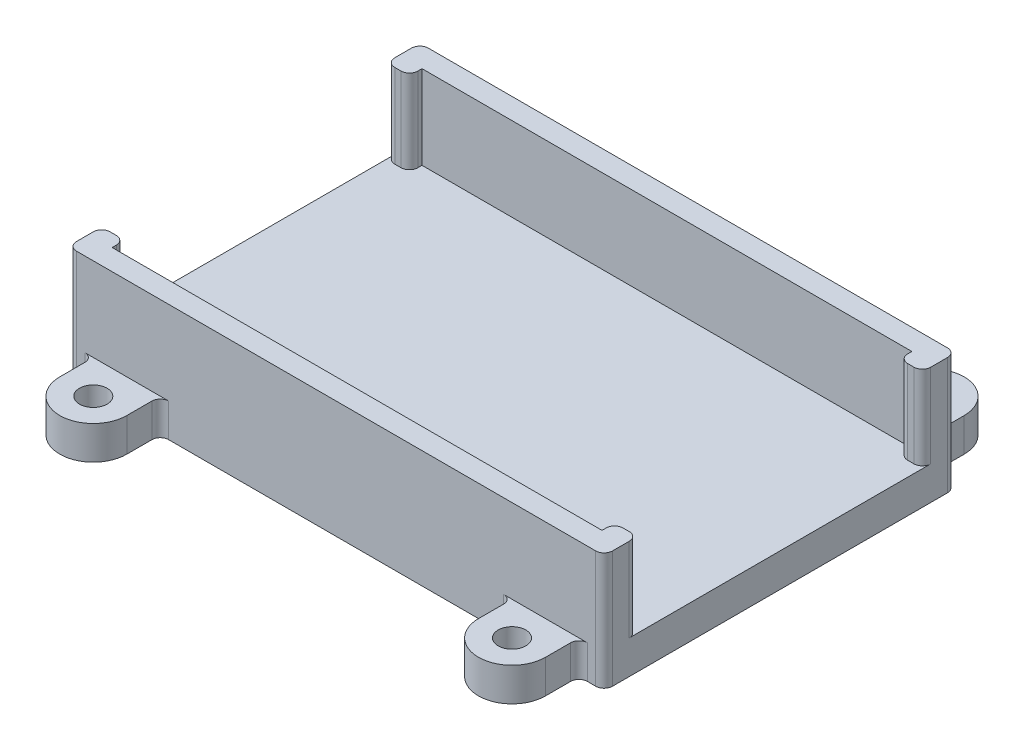
from build123d import *

# Parameters (mm, degrees)
BOSS_EXTRUDE1_DEPTH   = 14
CUT_EXTRUDE1_START    = -10
CUT_EXTRUDE1_DEPTH    = 10
M4X0_7_TAPPED_HOLE1_D = 3.3
FILLET2_R             = 1


with BuildPart() as part:
    # Sketch1 → Boss-Extrude1 (new body)
    with BuildSketch(Plane(origin=(0, 0, 0), x_dir=(1, 0, 0), z_dir=(0, 1, 0))):
        with BuildLine():
            Line((-31, 21), (-30, 21))
            ThreePointArc((-30, 21), (-29.292893219, 21.292893219), (-29, 22))
            Line((-29, 22), (-29, 25))
            ThreePointArc((-29, 25), (-25, 29), (-21, 25))
            Line((-21, 25), (-21, 22))
            ThreePointArc((-21, 22), (-20.707106781, 21.292893219), (-20, 21))
            Line((-20, 21), (20, 21))
            ThreePointArc((20, 21), (20.707106781, 21.292893219), (21, 22))
            Line((21, 22), (21, 25))
            ThreePointArc((21, 25), (25, 29), (29, 25))
            Line((29, 25), (29, 22))
            ThreePointArc((29, 22), (29.292893219, 21.292893219), (30, 21))
            Line((30, 21), (31, 21))
            ThreePointArc((31, 21), (31.707106781, 20.707106781), (32, 20))
            Line((32, 20), (32, -20))
            ThreePointArc((32, -20), (31.707106781, -20.707106781), (31, -21))
            Line((31, -21), (30, -21))
            ThreePointArc((30, -21), (29.292893219, -21.292893219), (29, -22))
            Line((29, -22), (29, -25))
            ThreePointArc((29, -25), (25, -29), (21, -25))
            Line((21, -25), (21, -22))
            ThreePointArc((21, -22), (20.707106781, -21.292893219), (20, -21))
            Line((20, -21), (-20, -21))
            ThreePointArc((-20, -21), (-20.707106781, -21.292893219), (-21, -22))
            Line((-21, -22), (-21, -25))
            ThreePointArc((-21, -25), (-25, -29), (-29, -25))
            Line((-29, -25), (-29, -22))
            ThreePointArc((-29, -22), (-29.292893219, -21.292893219), (-30, -21))
            Line((-30, -21), (-31, -21))
            ThreePointArc((-31, -21), (-31.707106781, -20.707106781), (-32, -20))
            Line((-32, -20), (-32, 20))
            ThreePointArc((-32, 20), (-31.707106781, 20.707106781), (-31, 21))
        make_face()
    extrude(amount=BOSS_EXTRUDE1_DEPTH)

    # Sketch2 → Cut-Extrude1 (cut)
    with BuildSketch(Plane(origin=(0, 14, 0), x_dir=(1, 0, 0), z_dir=(0, 1, 0)).offset(CUT_EXTRUDE1_START)):
        with BuildLine():
            Line((-30, -21), (-20, -21))
            ThreePointArc((-20, -21), (-20.707106781, -21.292893219), (-21, -22))
            Line((-21, -22), (-21, -25))
            ThreePointArc((-21, -25), (-25, -29), (-29, -25))
            Line((-29, -25), (-29, -22))
            ThreePointArc((-29, -22), (-29.292893219, -21.292893219), (-30, -21))
        make_face()
        Polygon((-29.25, 18.5), (29.25, 18.5), (29.25, 17), (32, 17), (32, -17), (29.25, -17), (29.25, -18.5), (-29.25, -18.5), (-29.25, -17), (-32, -17), (-32, 17), (-29.25, 17), align=None)
        with BuildLine():
            Line((21, -25), (21, -22))
            ThreePointArc((21, -22), (20.707106781, -21.292893219), (20, -21))
            Line((20, -21), (30, -21))
            ThreePointArc((30, -21), (29.292893219, -21.292893219), (29, -22))
            Line((29, -22), (29, -25))
            ThreePointArc((29, -25), (25, -29), (21, -25))
        make_face()
        with BuildLine():
            Line((30, 21), (20, 21))
            ThreePointArc((20, 21), (20.707106781, 21.292893219), (21, 22))
            Line((21, 22), (21, 25))
            ThreePointArc((21, 25), (25, 29), (29, 25))
            Line((29, 25), (29, 22))
            ThreePointArc((29, 22), (29.292893219, 21.292893219), (30, 21))
        make_face()
        with BuildLine():
            Line((-21, 25), (-21, 22))
            ThreePointArc((-21, 22), (-20.707106781, 21.292893219), (-20, 21))
            Line((-20, 21), (-30, 21))
            ThreePointArc((-30, 21), (-29.292893219, 21.292893219), (-29, 22))
            Line((-29, 22), (-29, 25))
            ThreePointArc((-29, 25), (-25, 29), (-21, 25))
        make_face()
    extrude(amount=CUT_EXTRUDE1_DEPTH, mode=Mode.SUBTRACT)

    # M4x0.7 Tapped Hole1 (through all)
    with Locations(Plane(origin=(0, 4, 0), x_dir=(1, 0, 0), z_dir=(0, 1, 0))):
        with Locations((-25, 25), (25, 25), (25, -25), (-25, -25)):
            Hole(M4X0_7_TAPPED_HOLE1_D / 2)

    # Fillet2
    fillet2_edges = [part.edges().sort_by_distance(p)[0] for p in [
        (-29.25, 9, -17),
        (29.25, 9, -17),
        (32, 9, -17),
        (32, 9, 17),
        (29.25, 9, 17),
        (-29.25, 9, 17),
        (-32, 9, 17),
        (-32, 9, -17),
    ]]
    fillet(fillet2_edges, radius=FILLET2_R)


solid = part.part
